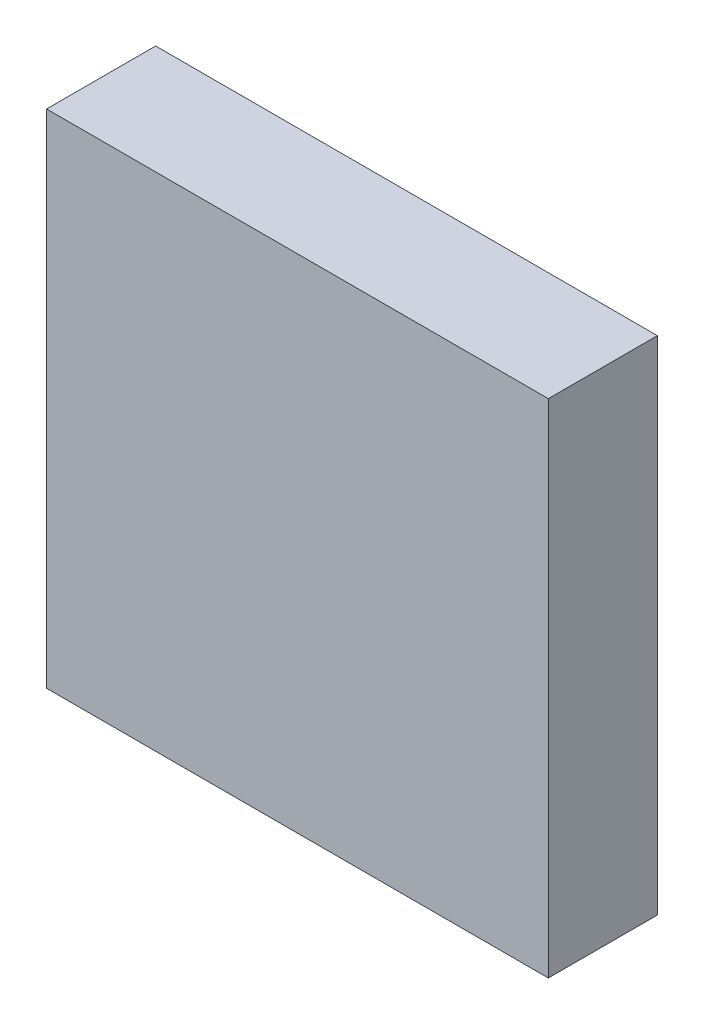
from build123d import *

# Parameters (mm, degrees)
SKETCH_1_W      = 23
SKETCH_1_H      = 23
EXTRUDE_1_DEPTH = 5


with BuildPart() as part:
    # 草图1 → 凸台-拉伸1 (new body)
    with BuildSketch(Plane.XY):
        with Locations((11.5, -11.5)):
            Rectangle(SKETCH_1_W, SKETCH_1_H)
    extrude(amount=EXTRUDE_1_DEPTH)


solid = part.part
